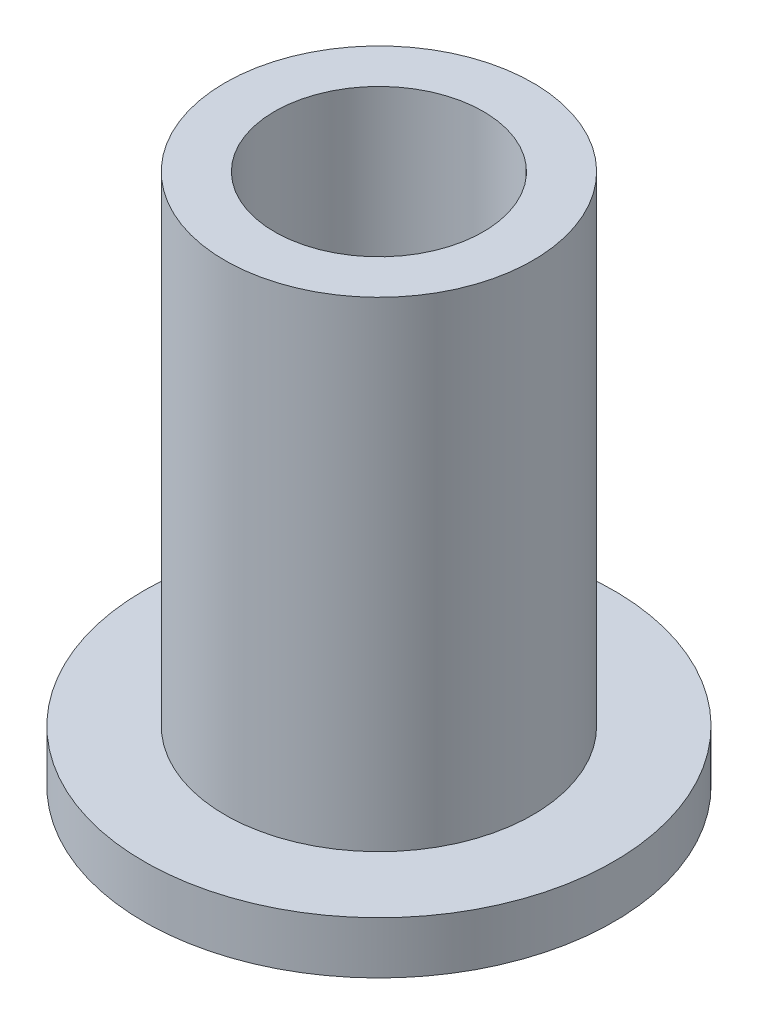
from build123d import *


with BuildPart() as part:
    # Sketch1 → Revolve1 (revolve)
    with BuildSketch(Plane.XY):
        Polygon((-2, -4.7), (-4.5, -4.7), (-4.5, -3.7), (-2.95, -3.7), (-2.95, 5.5), (-2, 5.5), align=None)
    revolve(axis=Axis((0, 9.885870746, 0), (0, -1, 0)))


solid = part.part
